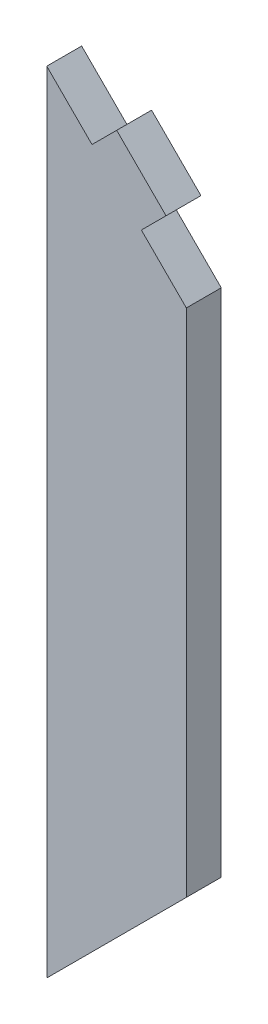
from build123d import *

# Parameters (mm, degrees)
BOSS_EXTRU_1_DEPTH = 6.35
ESQUISSE2_W        = 6.35
ESQUISSE2_H        = 12.7
BOSS_EXTRU_2_DEPTH = 6.35


with BuildPart() as part:
    # Esquisse1 → Boss.-Extru.1 (new body)
    with BuildSketch(Plane.XY):
        Polygon((-12.7, -71.84263), (12.7, -46.44263), (12.7, 46.44263), (-12.7, 71.84263), align=None)
    extrude(amount=BOSS_EXTRU_1_DEPTH)

    # Esquisse2 → Boss.-Extru.2 (add)
    with BuildSketch(Plane(origin=(29.571315, 29.571315, 0), x_dir=(0, 0, -1), z_dir=(0.707106781186549, 0.7071067811865461, 0))):
        with Locations((-3.175, 41.784422488)):
            Rectangle(ESQUISSE2_W, ESQUISSE2_H)
    extrude(amount=BOSS_EXTRU_2_DEPTH)


solid = part.part
